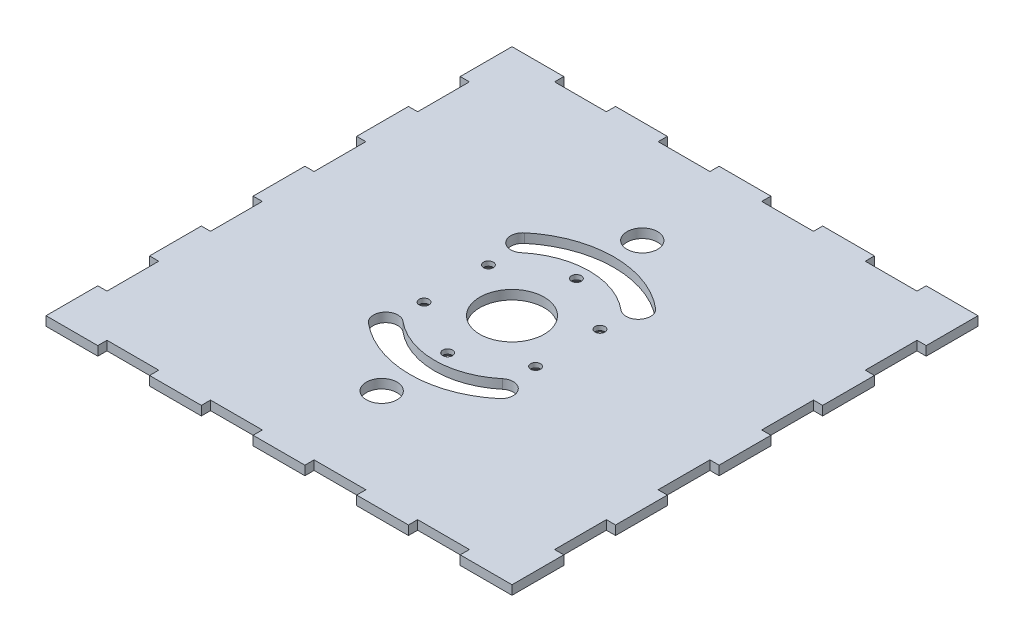
from build123d import *
from build123d.topology import SkipClean

# Parameters (mm, degrees)
BOSS_EXTRUDE1_DEPTH                      = 3
MIRROR1_AT_THE_SECOND_PLANE_COPY_1_DEPTH = 3
SKETCH2_R                                = 1.6
CUT_EXTRUDE1_DEPTH                       = 108.522090753
CHAMFER1_SIZE                            = 1.5
CIRPATTERN1_COUNT                        = 6
CHAMFER1_OF_CIRPATTERN1_SIZE             = 1.5
SKETCH3_R                                = 5
CUT_EXTRUDE2_DEPTH                       = 108.522090753


with BuildPart() as part:
    # Sketch1 → Boss-Extrude1 (new body)
    with BuildSketch(Plane(origin=(0, 0, 0), x_dir=(1, 0, 0), z_dir=(0, 1, 0))):
        with BuildLine():
            Line((-76, -76), (-59.111111111, -76))
            Line((-59.111111111, -76), (-59.111111111, -73))
            Line((-59.111111111, -73), (-42.222222222, -73))
            Line((-42.222222222, -73), (-42.222222222, -76))
            Line((-42.222222222, -76), (-25.333333333, -76))
            Line((-25.333333333, -76), (-25.333333333, -73))
            Line((-25.333333333, -73), (-8.444444444, -73))
            Line((-8.444444444, -73), (-8.444444444, -76))
            Line((-8.444444444, -76), (0, -76))
            Line((0, -76), (0, -10.5))
            ThreePointArc((0, -10.5), (-7.424621202, -7.424621202), (-10.5, 0))
            Line((-10.5, 0), (-76, 0))
            Line((-76, 0), (-76, -8.444444444))
            Line((-76, -8.444444444), (-73, -8.444444444))
            Line((-73, -8.444444444), (-73, -25.333333333))
            Line((-73, -25.333333333), (-76, -25.333333333))
            Line((-76, -25.333333333), (-76, -42.222222222))
            Line((-76, -42.222222222), (-73, -42.222222222))
            Line((-73, -42.222222222), (-73, -59.111111111))
            Line((-73, -59.111111111), (-76, -59.111111111))
            Line((-76, -59.111111111), (-76, -76))
        make_face()
    boss_extrude1 = extrude(amount=BOSS_EXTRUDE1_DEPTH)

    # Mirror1 at the second plane: Boss-Extrude1 across plane
    add(boss_extrude1.mirror(Plane(origin=(0, 0, 0), x_dir=(0, 0, 1), z_dir=(1, 0, 0))))



with BuildPart() as mirror1_1:
    # Mirror1: Boss-Extrude1 across plane
    add(boss_extrude1.mirror(Plane.XY))


with BuildPart() as part_1:
    with SkipClean():  # the faces are left unmerged after this step: merging them gives an invalid solid
        add(part.part)

        add(mirror1_1.part)  # Mirror1 at the second plane copy 1 merges Mirror1_1
        # Mirror1 at the second plane copy 1 sketc → Mirror1 at the second plane copy 1 (add)
        with BuildSketch(Plane(origin=(0, 0, 0), x_dir=(-1, 0, 0), z_dir=(0, 1, 0))):
            with BuildLine():
                Line((-76, -76), (-59.111111111, -76))
                Line((-59.111111111, -76), (-59.111111111, -73))
                Line((-59.111111111, -73), (-42.222222222, -73))
                Line((-42.222222222, -73), (-42.222222222, -76))
                Line((-42.222222222, -76), (-25.333333333, -76))
                Line((-25.333333333, -76), (-25.333333333, -73))
                Line((-25.333333333, -73), (-8.444444444, -73))
                Line((-8.444444444, -73), (-8.444444444, -76))
                Line((-8.444444444, -76), (0, -76))
                Line((0, -76), (0, -10.5))
                ThreePointArc((0, -10.5), (-7.424621202, -7.424621202), (-10.5, 0))
                Line((-10.5, 0), (-76, 0))
                Line((-76, 0), (-76, -8.444444444))
                Line((-76, -8.444444444), (-73, -8.444444444))
                Line((-73, -8.444444444), (-73, -25.333333333))
                Line((-73, -25.333333333), (-76, -25.333333333))
                Line((-76, -25.333333333), (-76, -42.222222222))
                Line((-76, -42.222222222), (-73, -42.222222222))
                Line((-73, -42.222222222), (-73, -59.111111111))
                Line((-73, -59.111111111), (-76, -59.111111111))
                Line((-76, -59.111111111), (-76, -76))
            make_face()
        extrude(amount=MIRROR1_AT_THE_SECOND_PLANE_COPY_1_DEPTH)

    # Sketch2 → Cut-Extrude1 (cut, through all)
    with SkipClean():  # the faces are left unmerged after this step: merging them gives an invalid solid
        with BuildSketch(Plane(origin=(0, 3, 0), x_dir=(1, 0, 0), z_dir=(0, 1, 0))):
            with Locations(Location((0, 21, 0), (0, 0, 270))):
                Circle(SKETCH2_R)
        cut_extrude1 = extrude(amount=-CUT_EXTRUDE1_DEPTH, mode=Mode.SUBTRACT)

    # Chamfer1
    chamfer1_edges = [part_1.edges().sort_by_distance(p)[0] for p in [
        (-1.6, 0, -21),
    ]]
    chamfer(chamfer1_edges, length=CHAMFER1_SIZE)

    # CirPattern1: Cut-Extrude1 ×6 about axis
    cirpattern1_axis = Axis((0, 0, 0), (0, 1, 0))
    for i in range(1, CIRPATTERN1_COUNT):
        add(cut_extrude1.rotate(cirpattern1_axis, i * 360 / CIRPATTERN1_COUNT), mode=Mode.SUBTRACT)

    # Chamfer1 of CirPattern1
    chamfer1_of_cirpattern1_edges = [part_1.edges().sort_by_distance(p)[0] for p in [
        (-18.986533479, 0, -9.114359354),
        (-17.386533479, 0, 11.885640646),
        (1.6, 0, 21),
        (18.986533479, 0, 9.114359354),
        (17.386533479, 0, -11.885640646),
    ]]
    chamfer(chamfer1_of_cirpattern1_edges, length=CHAMFER1_OF_CIRPATTERN1_SIZE)

    # Sketch3 → Cut-Extrude2 (cut, through all)
    with BuildSketch(Plane(origin=(0, 3, 0), x_dir=(1, 0, 0), z_dir=(0, 1, 0))):
        with Locations(Location((0, 42.5, 0), (0, 0, 270))):
            Circle(SKETCH3_R)
        with BuildLine():
            ThreePointArc((-21.372688022, 25.470977734), (-21.865715356, 19.835649522), (-16.230387145, 19.342622189))
            ThreePointArc((-16.230387145, 19.342622189), (0, 25.25), (16.230387145, 19.342622189))
            ThreePointArc((16.230387145, 19.342622189), (21.865715356, 19.835649522), (21.372688022, 25.470977734))
            ThreePointArc((21.372688022, 25.470977734), (0, 33.25), (-21.372688022, 25.470977734))
        make_face()
    cut_extrude2 = extrude(amount=-CUT_EXTRUDE2_DEPTH, mode=Mode.SUBTRACT)

    # Mirror2: Cut-Extrude2 across plane
    add(cut_extrude2.mirror(Plane.XY), mode=Mode.SUBTRACT)


solid = part_1.part
